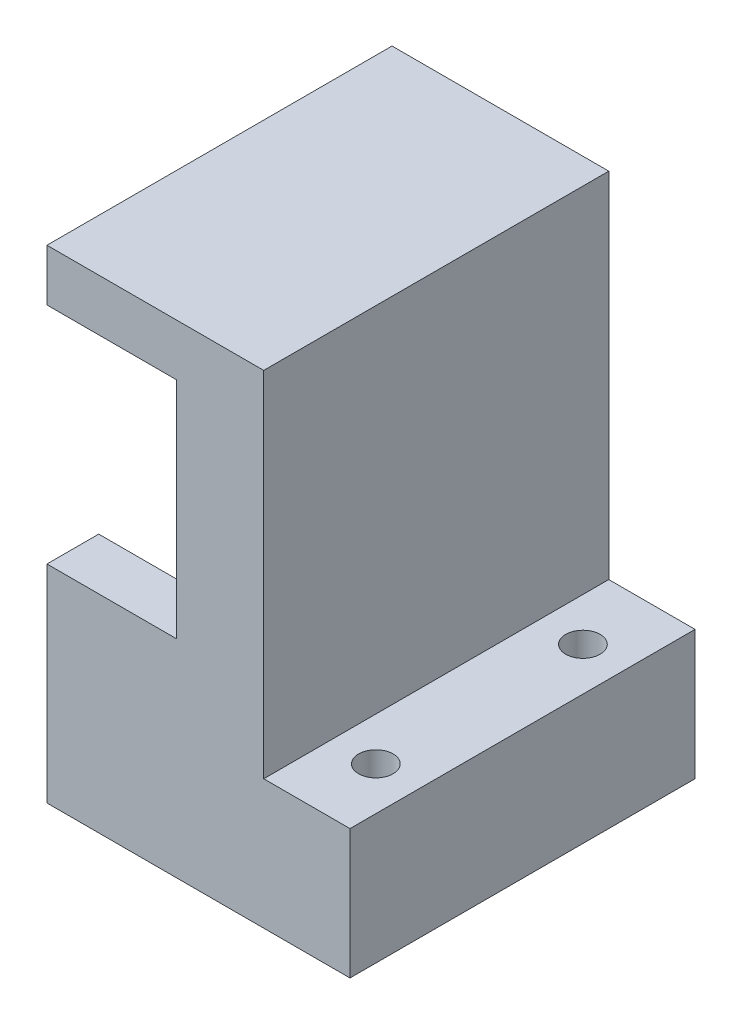
from build123d import *

# Parameters (mm, degrees)
BOSS_EXTRU_1_DEPTH  = 40
SKETCH1_R           = 2
CUT_EXTRUDE1_DEPTH  = 29
SKETCH2_W           = 15
SKETCH2_H           = 9
BOSS_EXTRUDE1_DEPTH = 6


with BuildPart() as part:
    # Esquisse1 → Boss.-Extru.1 (new body)
    with BuildSketch(Plane.XY):
        Polygon((0, 0), (-15, 0), (-15, -6), (0, -6), (0, -41), (-15, -41), (-15, -56), (20.126965986, -56), (20.126965986, -41), (10.126965986, -41), (10.126965986, 0), align=None)
    extrude(amount=BOSS_EXTRU_1_DEPTH)

    # Sketch1 → Cut-Extrude1 (cut)
    with BuildSketch(Plane(origin=(0, -41, 0), x_dir=(1, 0, 0), z_dir=(0, 1, 0))):
        with Locations(Location((15.126965986, -8, 0), (0, 0, 270))):
            Circle(SKETCH1_R)
        with Locations(Location((15.126965986, -32, 0), (0, 0, 270))):
            Circle(SKETCH1_R)
    extrude(amount=-CUT_EXTRUDE1_DEPTH, mode=Mode.SUBTRACT)

    # Sketch2 → Boss-Extrude1 (add)
    with BuildSketch(Plane.XY.offset(40)):
        with Locations((-7.5, -36.5)):
            Rectangle(SKETCH2_W, SKETCH2_H)
    extrude(amount=-BOSS_EXTRUDE1_DEPTH)


solid = part.part
